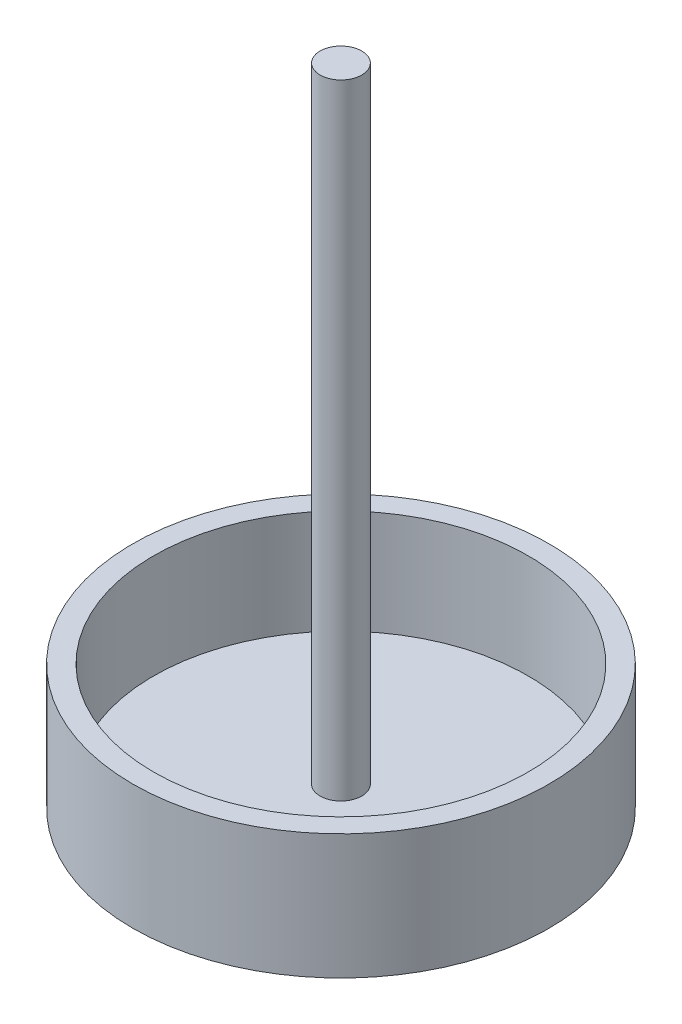
from build123d import *

# Parameters (mm, degrees)
SKETCH1_R           = 5
BOSS_EXTRUDE1_DEPTH = 3
SKETCH2_R           = 4.5
CUT_EXTRUDE1_DEPTH  = 2.5
SKETCH3_R           = 0.5
BOSS_EXTRUDE2_DEPTH = 15


with BuildPart() as part:
    # Sketch1 → Boss-Extrude1 (new body)
    with BuildSketch(Plane(origin=(0, 0, 0), x_dir=(1, 0, 0), z_dir=(0, 1, 0))):
        with Locations(Location((0, 0, 0), (0, 0, 270))):
            Circle(SKETCH1_R)
    extrude(amount=BOSS_EXTRUDE1_DEPTH)

    # Sketch2 → Cut-Extrude1 (cut)
    with BuildSketch(Plane(origin=(0, 3, 0), x_dir=(1, 0, 0), z_dir=(0, 1, 0))):
        with Locations(Location((0, 0, 0), (0, 0, 270))):
            Circle(SKETCH2_R)
    extrude(amount=-CUT_EXTRUDE1_DEPTH, mode=Mode.SUBTRACT)

    # Sketch3 → Boss-Extrude2 (add)
    with BuildSketch(Plane(origin=(0, 0.5, 0), x_dir=(1, 0, 0), z_dir=(0, 1, 0))):
        with Locations(Location((0, 0, 0), (0, 0, 270))):
            Circle(SKETCH3_R)
    extrude(amount=BOSS_EXTRUDE2_DEPTH)


solid = part.part
